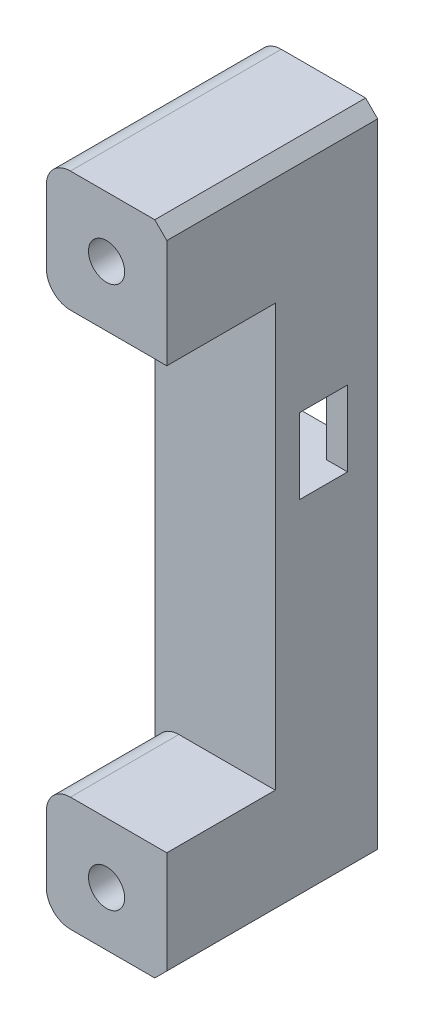
from build123d import *

# Parameters (mm, degrees)
SKETCH_1_W          = 20
SKETCH_1_H          = 19
SKETCH_1_R          = 3
EXTRUDE_1_DEPTH     = 18
SKETCH_1_H_2        = 20
EXTRUDE_1_2_DEPTH   = 18
SKETCH_2_W          = 20
SKETCH_2_H          = 109
SKETCH_2_R          = 3
EXTRUDE_2_DEPTH     = 4
EXTRUDE_3_DEPTH     = 6
SKETCH_4_R          = 0.9
CUT_EXTRUDE_1_DEPTH = 788.391009845
SKETCH_5_R          = 3
EXTRUDE_4_DEPTH     = 13
CHAMFER_1_SIZE      = 2
SKETCH_6_W          = 3.5
SKETCH_6_H          = 12.5
EXTRUDE_5_DEPTH     = 5
FILLET_1_R          = 4
CHAMFER_2_SIZE      = 2


with BuildPart() as part:
    # Эскиз1 → Бобышка-Вытянуть1 (new body)
    with BuildSketch(Plane(origin=(0, 0, 241.9894311), x_dir=(-1, 0, 0), z_dir=(0, 0, -1))):
        with Locations((770.850538245, -0.64131648)):
            Rectangle(SKETCH_1_W, SKETCH_1_H)
        with Locations(Location((770.850538245, -1.14131648, 0), (0, 0, 90))):
            Circle(SKETCH_1_R, mode=Mode.SUBTRACT)
    extrude(amount=EXTRUDE_1_DEPTH)



with BuildPart() as body_2:
    # Эскиз1 → Extrude 1 2 (new body)
    with BuildSketch(Plane(origin=(0, 0, 241.9894311), x_dir=(-1, 0, 0), z_dir=(0, 0, -1))):
        with Locations((770.850538245, 88.85868352)):
            Rectangle(SKETCH_1_W, SKETCH_1_H_2)
        with Locations(Location((770.850538245, 88.85868352, 0), (0, 0, 90))):
            Circle(SKETCH_1_R, mode=Mode.SUBTRACT)
    extrude(amount=EXTRUDE_1_2_DEPTH)


with BuildPart() as part_1:
    add(part.part)

    add(body_2.part)  # Бобышка-Вытянуть2 merges body 2
    # Эскиз2 → Бобышка-Вытянуть2 (add)
    with BuildSketch(Plane(origin=(0, 0, 223.9894311), x_dir=(-1, 0, 0), z_dir=(0, 0, -1))):
        with Locations((770.850538245, 44.35868352)):
            Rectangle(SKETCH_2_W, SKETCH_2_H)
        with Locations(Location((770.850538245, 88.85868352, 0), (0, 0, 90))):
            Circle(SKETCH_2_R, mode=Mode.SUBTRACT)
        with Locations(Location((770.850538245, -1.14131648, 0), (0, 0, 90))):
            Circle(SKETCH_2_R, mode=Mode.SUBTRACT)
    extrude(amount=EXTRUDE_2_DEPTH)

    # Эскиз3 → Бобышка-Вытянуть3 (add)
    with BuildSketch(Plane(origin=(0, 0, 219.9894311), x_dir=(-1, 0, 0), z_dir=(0, 0, -1))):
        Polygon((780.850538245, 59.85868352), (780.850538245, 51.85868352), (777.850538245, 51.85868352), (777.850538245, 48.60868352), (769.850538245, 48.60868352), (769.850538245, 61.10868352), (777.850538245, 61.10868352), (777.850538245, 59.85868352), align=None)
    extrude(amount=EXTRUDE_3_DEPTH)

    # Эскиз4 → Вырез-Вытянуть1 (cut, through all)
    with BuildSketch(Plane(origin=(0, 0, 219.9894311), x_dir=(-1, 0, 0), z_dir=(0, 0, -1))):
        with Locations(Location((775.850538245, 50.85868352, 0), (0, 0, 90))):
            Circle(SKETCH_4_R)
        with Locations(Location((775.850538245, 58.85868352, 0), (0, 0, 90))):
            Circle(SKETCH_4_R)
    extrude(amount=CUT_EXTRUDE_1_DEPTH, mode=Mode.SUBTRACT)

    # Эскиз5 → Бобышка-Вытянуть4 (add)
    # profile 1 of 2: a face of its own
    with BuildSketch(Plane(origin=(0, 0, 219.9894311), x_dir=(-1, 0, 0), z_dir=(0, 0, -1))):
        Polygon((760.850538245, -10.14131648), (780.850538245, -10.14131648), (780.850538245, 51.85868352), (777.850538245, 51.85868352), (777.850538245, 48.60868352), (760.850538245, 48.60868352), align=None)
        with Locations(Location((770.850538245, -1.14131648, 0), (0, 0, 90))):
            Circle(SKETCH_5_R, mode=Mode.SUBTRACT)
    # profile 2 of 2: a face of its own
    with BuildSketch(Plane(origin=(0, 0, 219.9894311), x_dir=(-1, 0, 0), z_dir=(0, 0, -1))):
        Polygon((777.850538245, 61.10868352), (777.850538245, 59.85868352), (780.850538245, 59.85868352), (780.850538245, 98.85868352), (760.850538245, 98.85868352), (760.850538245, 61.10868352), align=None)
        with Locations(Location((770.850538245, 88.85868352, 0), (0, 0, 90))):
            Circle(SKETCH_5_R, mode=Mode.SUBTRACT)
    extrude(amount=EXTRUDE_4_DEPTH)

    # Фаска1
    chamfer_1_edges = [part_1.edges().sort_by_distance(p)[0] for p in [
        (-780.850538245, 59.85868352, 210.4894311),
        (-780.850538245, 55.85868352, 213.9894311),
        (-780.850538245, 51.85868352, 210.4894311),
    ]]
    chamfer(chamfer_1_edges, length=CHAMFER_1_SIZE)

    # Эскиз6 → Бобышка-Вытянуть5 (add)
    with BuildSketch(Plane(origin=(0, 0, 206.9894311), x_dir=(-1, 0, 0), z_dir=(0, 0, -1))):
        with Locations((762.600538245, 54.85868352)):
            Rectangle(SKETCH_6_W, SKETCH_6_H)
    extrude(amount=-EXTRUDE_5_DEPTH)

    # Скругление1
    fillet_1_edges = [part_1.edges().sort_by_distance(p)[0] for p in [
        (-780.850538245, 98.85868352, 224.4894311),
        (-780.850538245, 78.85868352, 232.9894311),
        (-780.850538245, 8.85868352, 232.9894311),
        (-780.850538245, -10.14131648, 224.4894311),
    ]]
    fillet(fillet_1_edges, radius=FILLET_1_R)

    # Фаска2
    chamfer_2_edges = [part_1.edges().sort_by_distance(p)[0] for p in [
        (-760.850538245, 98.85868352, 224.4894311),
        (-760.850538245, -10.14131648, 224.4894311),
    ]]
    chamfer(chamfer_2_edges, length=CHAMFER_2_SIZE)


solid = part_1.part
